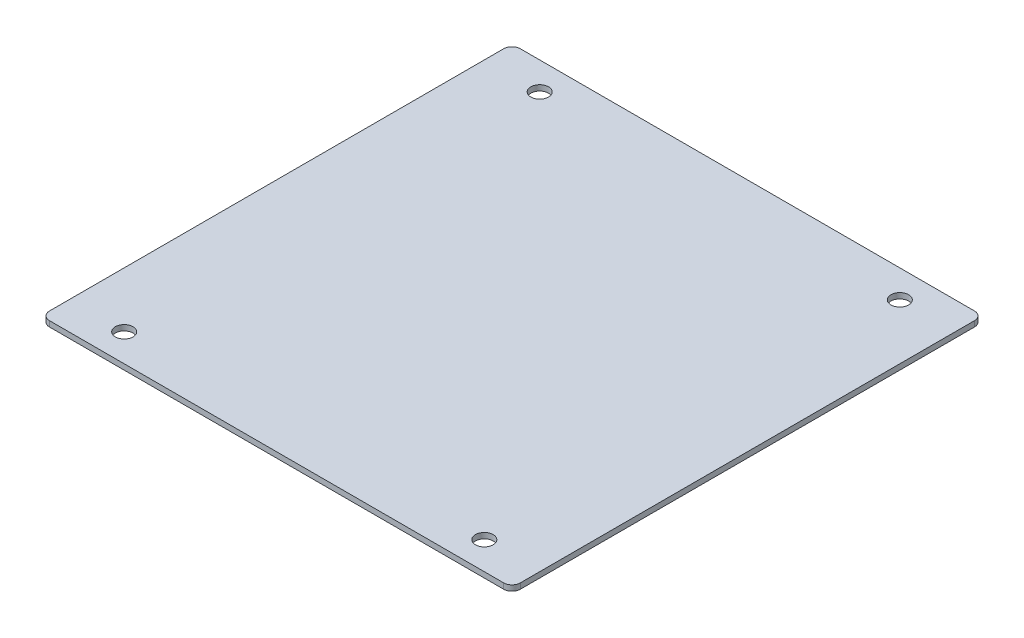
from build123d import *

# Parameters (mm, degrees)
SKETCH1_W            = 170
SKETCH1_H            = 170
BOSS_EXTRUDE1_DEPTH  = 2
FILLET1_R            = 3
M6_CLEARANCE_HOLE1_D = 6.4


with BuildPart() as part:
    # Sketch1 → Boss-Extrude1 (new body)
    with BuildSketch(Plane(origin=(0, 0, 0), x_dir=(1, 0, 0), z_dir=(0, 1, 0))):
        Rectangle(SKETCH1_W, SKETCH1_H)
    extrude(amount=BOSS_EXTRUDE1_DEPTH)

    # Fillet1
    fillet1_edges = [part.edges().sort_by_distance(p)[0] for p in [
        (85, 1, 85),
        (-85, 1, 85),
        (-85, 1, -85),
        (85, 1, -85),
    ]]
    fillet(fillet1_edges, radius=FILLET1_R)

    # M6 Clearance Hole1 (through all)
    with Locations(Plane(origin=(0, 2, 0), x_dir=(1, 0, 0), z_dir=(0, 1, 0))):
        with Locations((-65, 75), (65, -75), (-65, -75), (65, 75)):
            Hole(M6_CLEARANCE_HOLE1_D / 2)


solid = part.part
